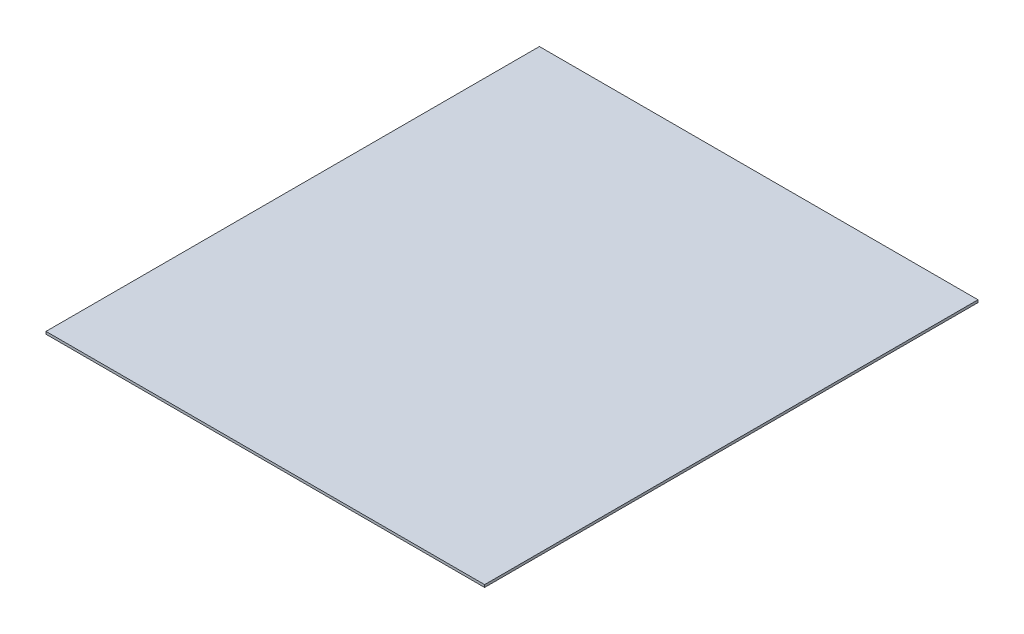
from build123d import *

# Parameters (mm, degrees)
CROQUIS1_W              = 1120.95
CROQUIS1_H              = 1260.95
SALIENTE_EXTRUIR1_DEPTH = 6.35


with BuildPart() as part:
    # Croquis1 → Saliente-Extruir1 (new body)
    with BuildSketch(Plane(origin=(0, 0, 0), x_dir=(1, 0, 0), z_dir=(0, 1, 0))):
        Rectangle(CROQUIS1_W, CROQUIS1_H)
    extrude(amount=SALIENTE_EXTRUIR1_DEPTH)


solid = part.part
